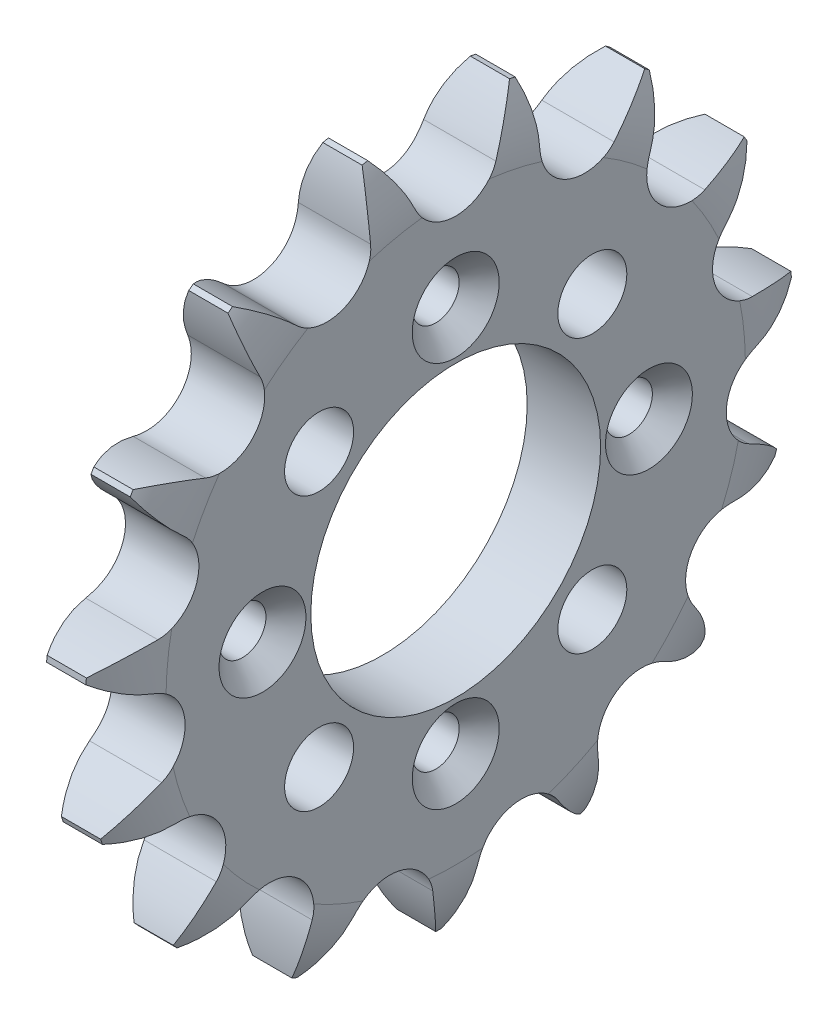
from build123d import *

# Parameters (mm, degrees)
TOOTHCUT_DEPTH                                      = 37.710811315
TEETHCUTS_COUNT                                     = 15
TEETHCUTS_ANGLE                                     = 336
BORSKE_R                                            = 5
BORE_DEPTH                                          = 50.0005
SKETCH1_R                                           = 10.5
CUT_EXTRUDE1_DEPTH                                  = 10
CSK_FOR_M3_COUNTERSUNK_FLAT_HEAD_SCREW2_D           = 3.4
CSK_FOR_M3_COUNTERSUNK_FLAT_HEAD_SCREW2_CSINK_D     = 6.3
CSK_FOR_M3_COUNTERSUNK_FLAT_HEAD_SCREW2_CSINK_ANGLE = 90
SKETCH5_R                                           = 2.5
CUT_EXTRUDE2_DEPTH                                  = 10


with BuildPart() as part:
    # BasProSke → Base-Revolve (revolve)
    with BuildSketch(Plane(origin=(0, 0, 0), x_dir=(1, 0, 0), z_dir=(0, 1, 0)), mode=Mode.PRIVATE) as base_revolve_sk:
        with BuildLine():
            Line((0, 0), (0, 20.988608354))
            ThreePointArc((0, 20.988608354), (0.314698702, 23.416771239), (1.238, 25.684484843))
            Line((1.238, 25.684484843), (4.0816, 25.684484843))
            ThreePointArc((4.0816, 25.684484843), (5.004901298, 23.416771239), (5.3196, 20.988608354))
            Line((5.3196, 20.988608354), (5.3196, 0))
            Line((5.3196, 0), (0, 0))
        make_face()
    revolve(base_revolve_sk.sketch.rotate(Axis((-10, 0, 0), (1, 0, 0)), 180), axis=Axis((-10, 0, 0), (1, 0, 0)))

    # TooCutSke → ToothCut (cut, through all)
    with BuildSketch(Plane(origin=(0, 0, 0), x_dir=(0, 0, -1), z_dir=(1, 0, 0))):
        with BuildLine():
            ThreePointArc((2.951828939, 21.685132796), (4.063020217, 23.756940993), (5.530366998, 25.593793922))
            ThreePointArc((5.530366998, 25.593793922), (0, 26.184484843), (-5.530366998, 25.593793922))
            ThreePointArc((-5.530366998, 25.593793922), (-4.063020217, 23.756940993), (-2.951828939, 21.685132796))
            ThreePointArc((-2.951828939, 21.685132796), (0, 19.731359843), (2.951828939, 21.685132796))
        make_face()
    toothcut = extrude(amount=TOOTHCUT_DEPTH, mode=Mode.SUBTRACT)

    # TeethCuts: ToothCut ×15 about axis
    teethcuts_axis = Axis((-10, 0, 0), (1, 0, 0))
    for i in range(1, TEETHCUTS_COUNT):
        add(toothcut.rotate(teethcuts_axis, i * TEETHCUTS_ANGLE / (TEETHCUTS_COUNT - 1)), mode=Mode.SUBTRACT)

    # BorSke → Bore (cut, symmetric)
    with BuildSketch(Plane(origin=(0, 0, 0), x_dir=(0, 0, -1), z_dir=(1, 0, 0))):
        with Locations(Location((0, 0, 0), (0, 0, 180))):
            Circle(BORSKE_R)
    extrude(amount=BORE_DEPTH, both=True, mode=Mode.SUBTRACT)

    # Sketch1 → Cut-Extrude1 (cut)
    with BuildSketch(Plane(origin=(5.3196, 0, 0), x_dir=(0, 0, -1), z_dir=(1, 0, 0))):
        Circle(SKETCH1_R)
    extrude(amount=-CUT_EXTRUDE1_DEPTH, mode=Mode.SUBTRACT)

    # CSK for M3 Countersunk Flat Head Screw2 (through all)
    with Locations(Plane(origin=(5.3196, 0, 0), x_dir=(0, 0, -1), z_dir=(1, 0, 0))):
        with Locations((0, 14), (-14, 0), (14, 0), (0, -14)):
            CounterSinkHole(CSK_FOR_M3_COUNTERSUNK_FLAT_HEAD_SCREW2_D / 2, CSK_FOR_M3_COUNTERSUNK_FLAT_HEAD_SCREW2_CSINK_D / 2, counter_sink_angle=CSK_FOR_M3_COUNTERSUNK_FLAT_HEAD_SCREW2_CSINK_ANGLE)

    # Sketch5 → Cut-Extrude2 (cut)
    with BuildSketch(Plane(origin=(5.3196, 0, 0), x_dir=(0, 0, -1), z_dir=(1, 0, 0))):
        with Locations((-9.899494937, 9.899494937)):
            Circle(SKETCH5_R)
        with Locations((9.899494937, 9.899494937)):
            Circle(SKETCH5_R)
        with Locations((9.899494937, -9.899494937)):
            Circle(SKETCH5_R)
        with Locations((-9.899494937, -9.899494937)):
            Circle(SKETCH5_R)
    extrude(amount=-CUT_EXTRUDE2_DEPTH, mode=Mode.SUBTRACT)


solid = part.part
